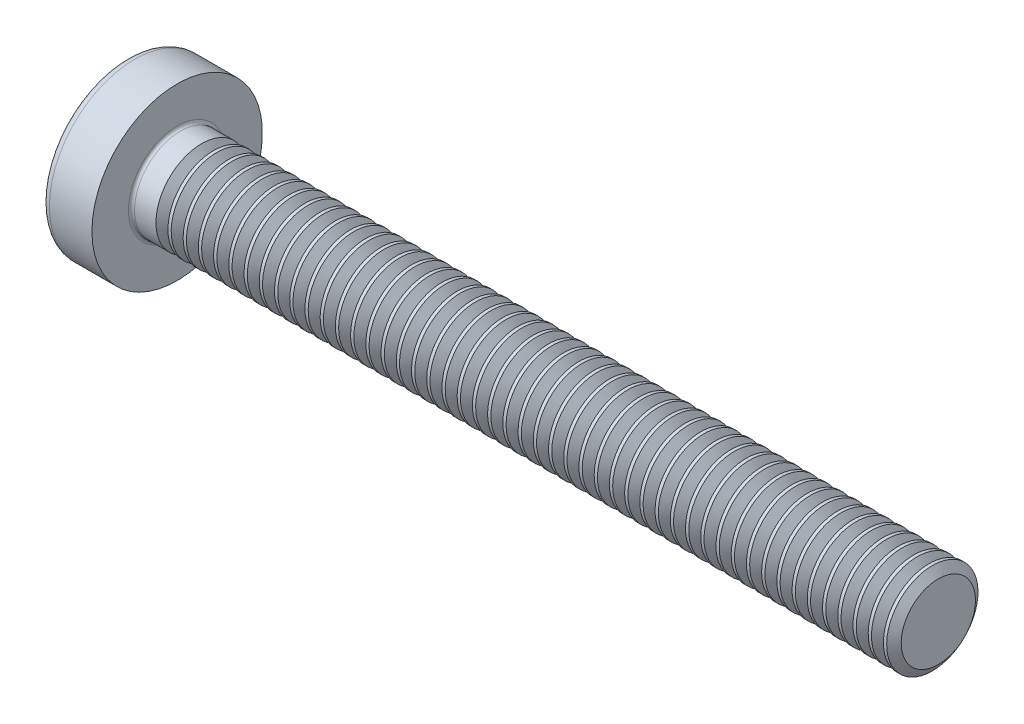
from build123d import *

# Parameters (mm, degrees)
FILLET1_R       = 0.1
RECPAT_COUNT    = 2
RECPAT_ANGLE    = 90
THDSCHPAT_COUNT = 49
THDSCHPAT_PITCH = 0.5


with BuildPart() as part:
    # BodySke → Base-Revolve (revolve)
    with BuildSketch(Plane.XY, mode=Mode.PRIVATE) as base_revolve_sk:
        with BuildLine():
            Line((2.4, 1.5), (2.4, 2.8))
            Line((2.4, 2.8), (1.003501533, 2.8))
            ThreePointArc((1.003501533, 2.8), (0.873295971, 2.76653015), (0.775371599, 2.674418605))
            ThreePointArc((0.775371599, 2.674418605), (0.197753546, 1.392274756), (0, 0))
            Line((0, 0), (27.4, 0))
            Line((27.4, 0), (27.4, 1.5))
            Line((27.4, 1.5), (2.4, 1.5))
        make_face()
    revolve(base_revolve_sk.sketch.rotate(Axis((1.003501533, 0, 0), (1, 0, 0)), 90), axis=Axis((1.003501533, 0, 0), (1, 0, 0)))

    # Fillet1
    fillet1_edges = [part.edges().sort_by_distance(p)[0] for p in [
        (2.4, 0, -1.5),
    ]]
    fillet(fillet1_edges, radius=FILLET1_R)

    # Sketch3 → Recess section 0
    with BuildSketch(Plane(origin=(0, 0, 0), x_dir=(0, 0, -1), z_dir=(1, 0, 0))):
        with BuildLine():
            Line((0.37, -1.4), (-0.37, -1.4))
            Line((-0.37, -1.4), (-0.37, 1.4))
            Line((-0.37, 1.4), (0.37, 1.4))
            Line((0.37, 1.4), (0.37, -1.4))
        make_face()
    # Sketch4 → Recess section 1
    with BuildSketch(Plane(origin=(1.75, 0, 0), x_dir=(0, 0, -1), z_dir=(1, 0, 0))):
        with BuildLine():
            Line((0.37, -0.527482332), (-0.37, -0.527482332))
            Line((-0.37, -0.527482332), (-0.37, 0.527482332))
            Line((-0.37, 0.527482332), (0.37, 0.527482332))
            Line((0.37, 0.527482332), (0.37, -0.527482332))
        make_face()
    recess = loft(mode=Mode.SUBTRACT)

    # RecPat: Recess ×2 about axis
    recpat_axis = Axis((0, 0, 0), (1, 0, 0))
    for i in range(1, RECPAT_COUNT):
        add(recess.rotate(recpat_axis, i * RECPAT_ANGLE / (RECPAT_COUNT - 1)), mode=Mode.SUBTRACT)

    # RecCorSke → RecessCore (revolve, cut)
    with BuildSketch(Plane.XY, mode=Mode.PRIVATE) as recesscore_sk:
        Polygon((0, 0), (0, 0.678371921), (1.75, 0.556), (1.930655351, 0), align=None)
    revolve(recesscore_sk.sketch.rotate(Axis((-3.175, 0, 0), (1, 0, 0)), 344.185974362), axis=Axis((-3.175, 0, 0), (1, 0, 0)), mode=Mode.SUBTRACT)

    # ThdSchSke → ThreadSchematic (revolve, cut)
    with BuildSketch(Plane.XY, mode=Mode.PRIVATE) as threadschematic_sk:
        Polygon((3.4, -1.2195), (3.203591786, -1.5), (3.203591786, -1.875), (3.596408214, -1.875), (3.596408214, -1.5), align=None)
    threadschematic = revolve(threadschematic_sk.sketch.rotate(Axis((-3.175, 0, 0), (1, 0, 0)), 270), axis=Axis((-3.175, 0, 0), (1, 0, 0)), mode=Mode.SUBTRACT)

    # ThdSchPat: ThreadSchematic ×49
    with Locations(*[(i * THDSCHPAT_PITCH, 0, 0) for i in range(1, THDSCHPAT_COUNT)]):
        add(threadschematic, mode=Mode.SUBTRACT)


solid = part.part
